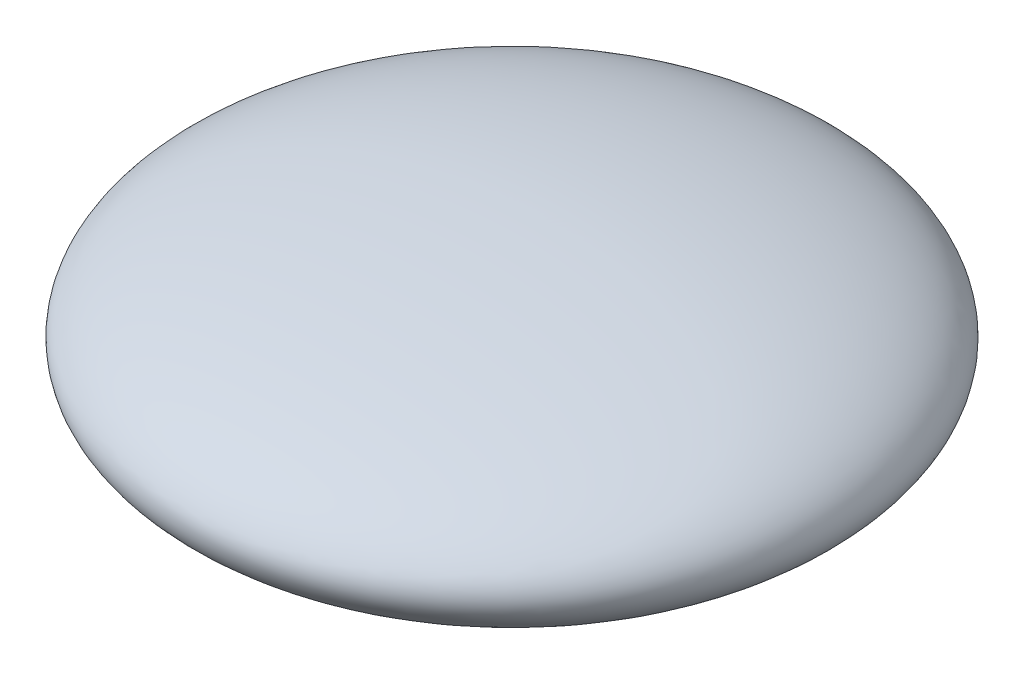
from build123d import *


with BuildPart() as part:
    # Sketch1 → Revolve3 (revolve)
    with BuildSketch(Plane.XY, mode=Mode.PRIVATE) as revolve3_sk:
        with BuildLine():
            Line((0, 14.3), (0, 0))
            Line((0, 0), (14.85, 0))
            Line((14.85, 0), (21.732978312, 3.499999995))
            add(Edge.make_bspline(
                [(21.732978312, 3.499999995), (42.971882861, 14.3), (0, 14.3)],
                knots=[5.766212054, 5.766212054, 5.766212054, 7.853981634, 7.853981634, 7.853981634], degree=2, weights=[1, 0.502866186, 1]))
        make_face()
    revolve(revolve3_sk.sketch.rotate(Axis((0, 0, 0), (0, 1, 0)), 90), axis=Axis((0, 0, 0), (0, 1, 0)))


solid = part.part
